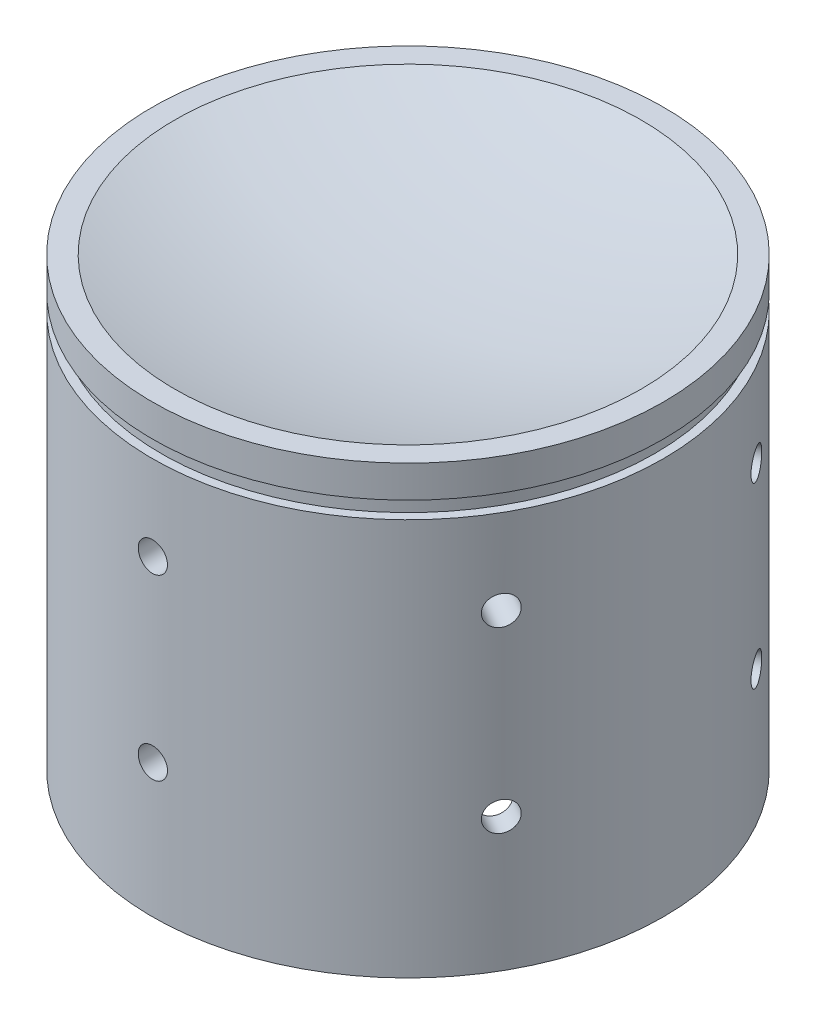
from build123d import *

# Parameters (mm, degrees)
F_19_0_164_DIAMETER_HOLE1_D = 4.1656
CIRPATTERN2_COUNT           = 6


with BuildPart() as part:
    # Sketch1 → Revolve2 (revolve)
    with BuildSketch(Plane.XY):
        with BuildLine():
            Line((0, -25.4), (33.2105, -25.4))
            Line((33.2105, -25.4), (33.2105, -63.5))
            Line((33.2105, -63.5), (36.3855, -63.5))
            Line((36.3855, -63.5), (36.3855, -6.985))
            Line((36.3855, -6.985), (35.1409, -6.985))
            Line((35.1409, -6.985), (35.1409, -4.572))
            Line((35.1409, -4.572), (36.3855, -4.572))
            Line((36.3855, -4.572), (36.3855, 0))
            Line((36.3855, 0), (33.2105, 0))
            ThreePointArc((33.2105, 0), (16.798390624, -3.802656831), (0, -5.08))
            Line((0, -5.08), (0, -25.4))
        make_face()
    revolve(axis=Axis((0, 0, 0), (0, -1, 0)))

    # #19 (0.164) Diameter Hole1 (through all)
    with Locations(Plane(origin=(0, -19.049997805, 36.3855), x_dir=(1, 0, 0), z_dir=(0, 0, 1))):
        with Locations((0, 0), (0, -25.400002195)):
            f_19_0_164_diameter_hole1 = Hole(F_19_0_164_DIAMETER_HOLE1_D / 2)

    # CirPattern2: #19 (0.164) Diameter Hole1 ×6 about axis
    cirpattern2_axis = Axis((0, 0, 0), (0, -1, 0))
    for i in range(1, CIRPATTERN2_COUNT):
        add(f_19_0_164_diameter_hole1.rotate(cirpattern2_axis, i * 360 / CIRPATTERN2_COUNT), mode=Mode.SUBTRACT)


solid = part.part
